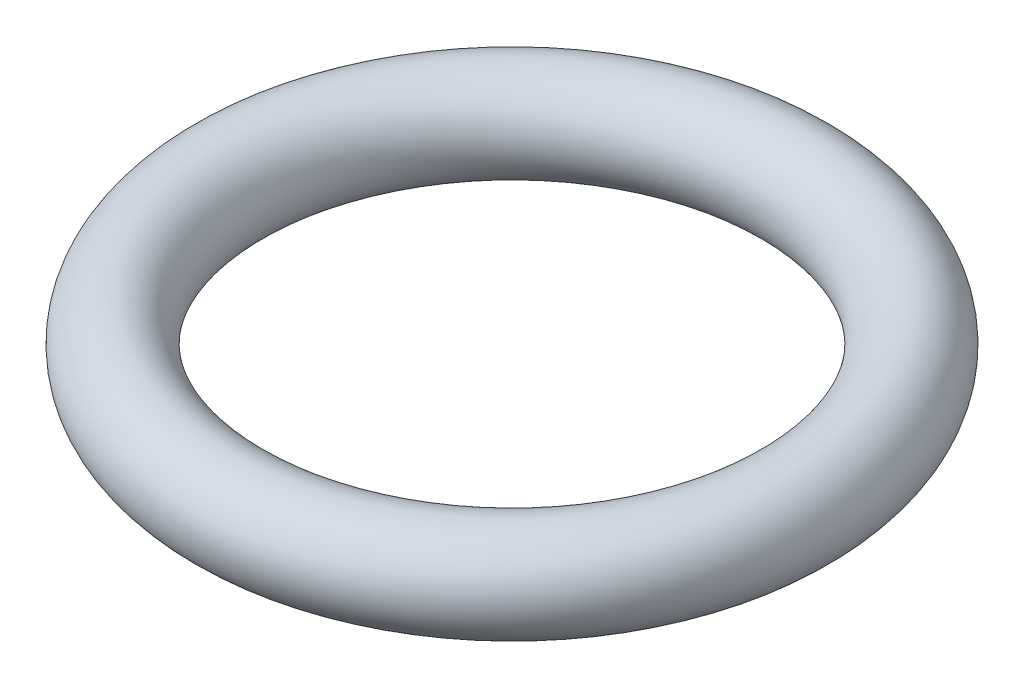
from build123d import *

# Parameters (mm, degrees)
SKETCH1_R = 0.5


with BuildPart() as part:
    # Sketch1 → Revolve1 (revolve)
    with BuildSketch(Plane.XY, mode=Mode.PRIVATE) as revolve1_sk:
        with Locations((3, 0)):
            Circle(SKETCH1_R)
    revolve(revolve1_sk.sketch.rotate(Axis((0, 0, 0), (0, 1, 0)), 90), axis=Axis((0, 0, 0), (0, 1, 0)))


solid = part.part
